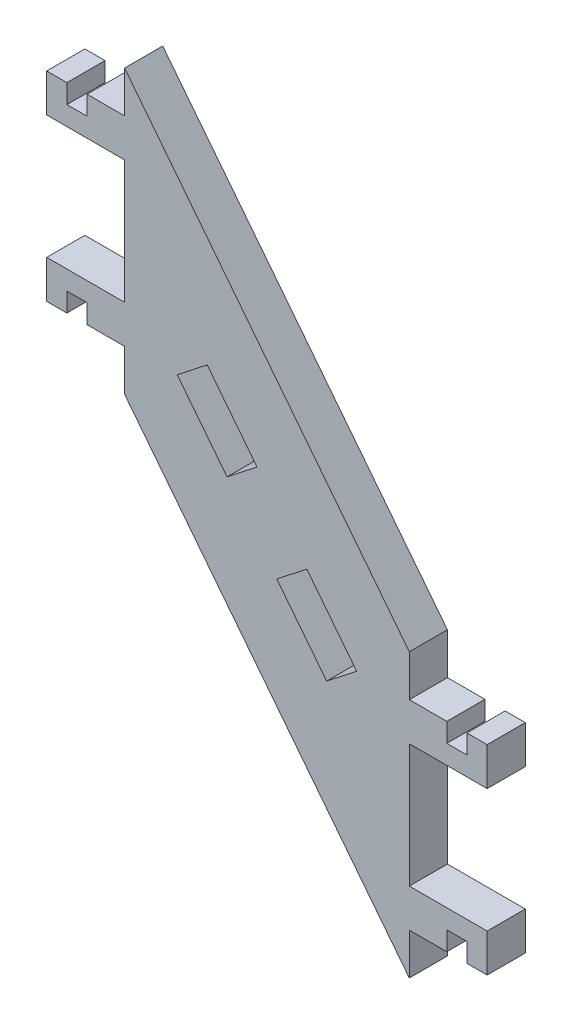
from build123d import *

# Parameters (mm, degrees)
PROFILE_DEPTH      = 6
CUT_EXTRUDE1_DEPTH = 98.93412639


with BuildPart() as part:
    # Sketch1 → Profile (new body)
    with BuildSketch(Plane.XY):
        Polygon((-44.8, 79.375), (-44.8, 72.85), (-50.699999884, 72.85), (-50.699999884, 69.85), (-53.874999884, 69.85), (-53.874999884, 72.85), (-57.049999884, 72.85), (-57.049999884, 66.85), (-44.8, 66.85), (-44.8, 47.45), (-57.049999884, 47.45), (-57.049999884, 41.45), (-53.874999884, 41.45), (-53.874999884, 44.45), (-50.699999884, 44.45), (-50.699999884, 41.45), (-44.8, 41.45), (-44.8, 34.925), (0, -22.225), (0, -15.7), (5.899999884, -15.7), (5.899999884, -12.7), (9.074999884, -12.7), (9.074999884, -15.7), (12.249999884, -15.7), (12.249999884, -9.7), (0, -9.7), (0, 9.7), (12.249999884, 9.7), (12.249999884, 15.7), (9.074999884, 15.7), (9.074999884, 12.7), (5.899999884, 12.7), (5.899999884, 15.7), (0, 15.7), (0, 22.225), align=None)
    extrude(amount=PROFILE_DEPTH)

    # Sketch2 → Cut-Extrude1 (cut, through all)
    with BuildSketch(Plane.XY.offset(6)):
        Polygon((-31.791661459, 45.418372437), (-36.51372588, 41.716736635), (-28.678596767, 31.721700278), (-23.956532346, 35.423336079), align=None)
        Polygon((-16.121403233, 25.428299722), (-8.28627412, 15.433263365), (-13.008338541, 11.731627563), (-20.843467654, 21.726663921), align=None)
    extrude(amount=-CUT_EXTRUDE1_DEPTH, mode=Mode.SUBTRACT)


solid = part.part
